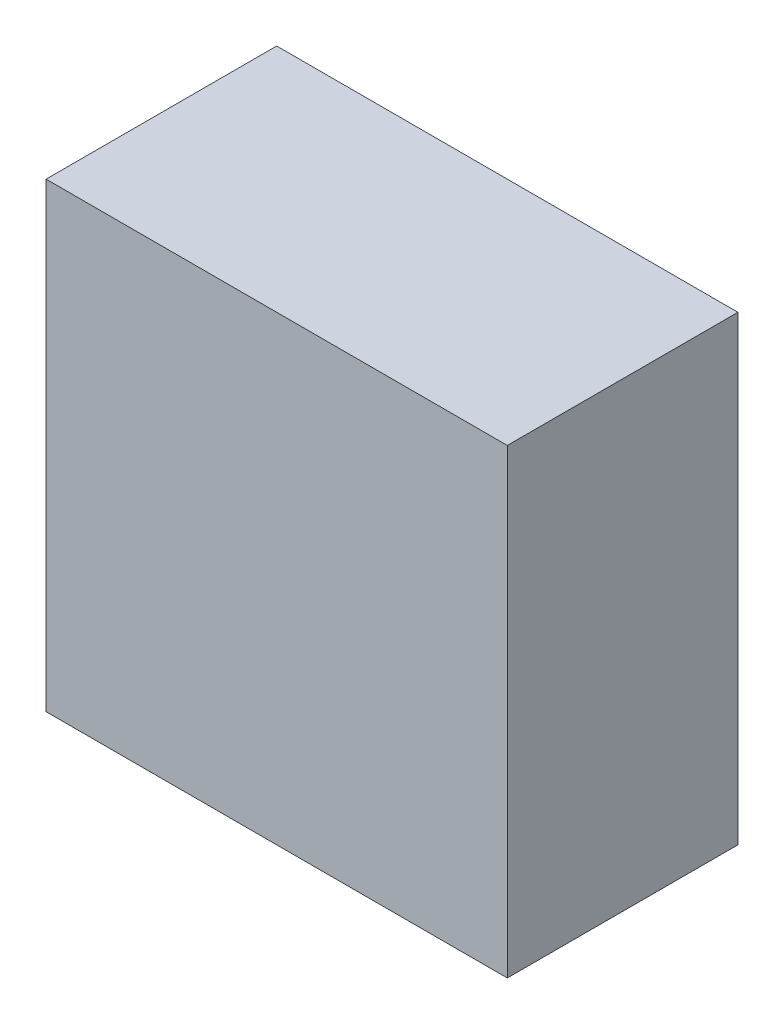
from build123d import *

# Parameters (mm, degrees)
SKETCH1_W           = 12.7
SKETCH1_H           = 6.35
BOSS_EXTRUDE1_DEPTH = 12.7


with BuildPart() as part:
    # Sketch1 → Boss-Extrude1 (new body)
    with BuildSketch(Plane(origin=(0, 0, 0), x_dir=(1, 0, 0), z_dir=(0, 1, 0))):
        with Locations((6.35, 3.175)):
            Rectangle(SKETCH1_W, SKETCH1_H)
    extrude(amount=BOSS_EXTRUDE1_DEPTH)


solid = part.part
